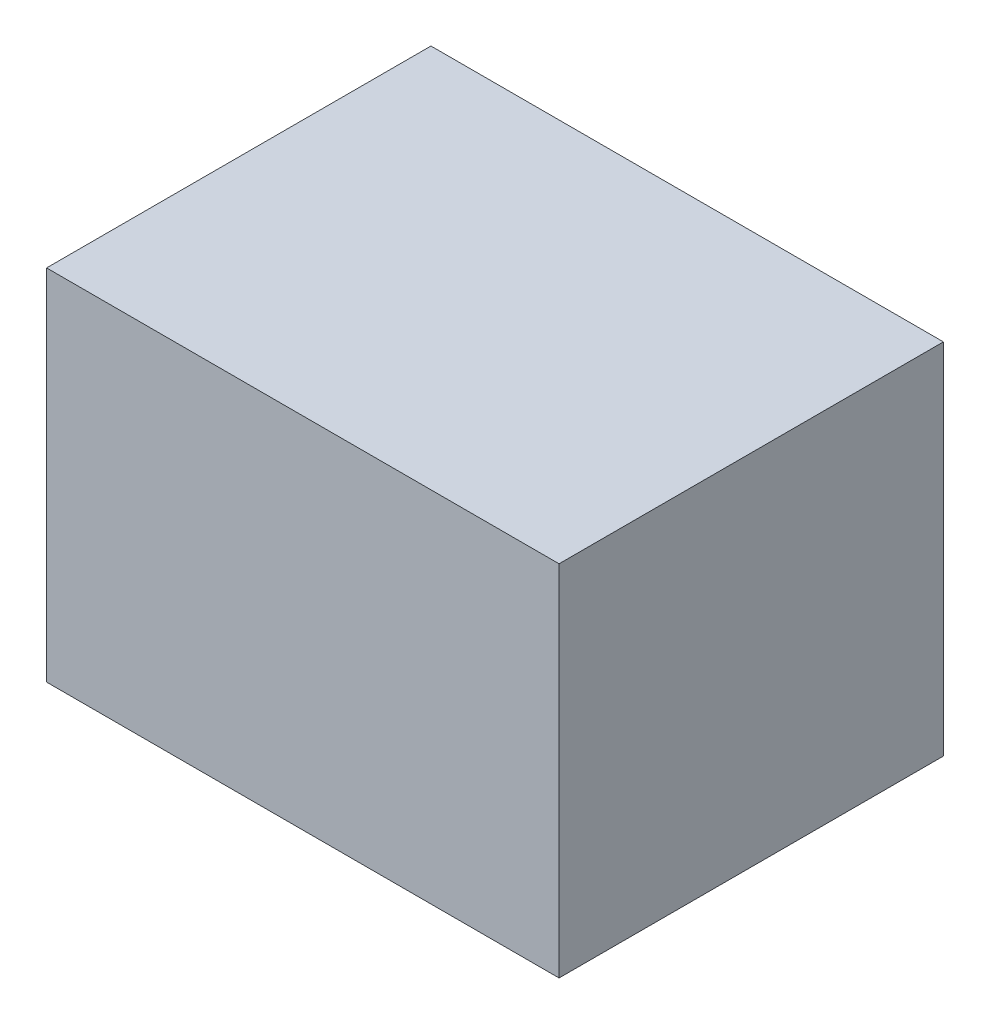
from build123d import *

# Parameters (mm, degrees)
SKETCH1_W           = 20
SKETCH1_H           = 14
BOSS_EXTRUDE1_DEPTH = 15


with BuildPart() as part:
    # Sketch1 → Boss-Extrude1 (new body)
    with BuildSketch(Plane.XY):
        Rectangle(SKETCH1_W, SKETCH1_H)
    extrude(amount=-BOSS_EXTRUDE1_DEPTH)


solid = part.part
